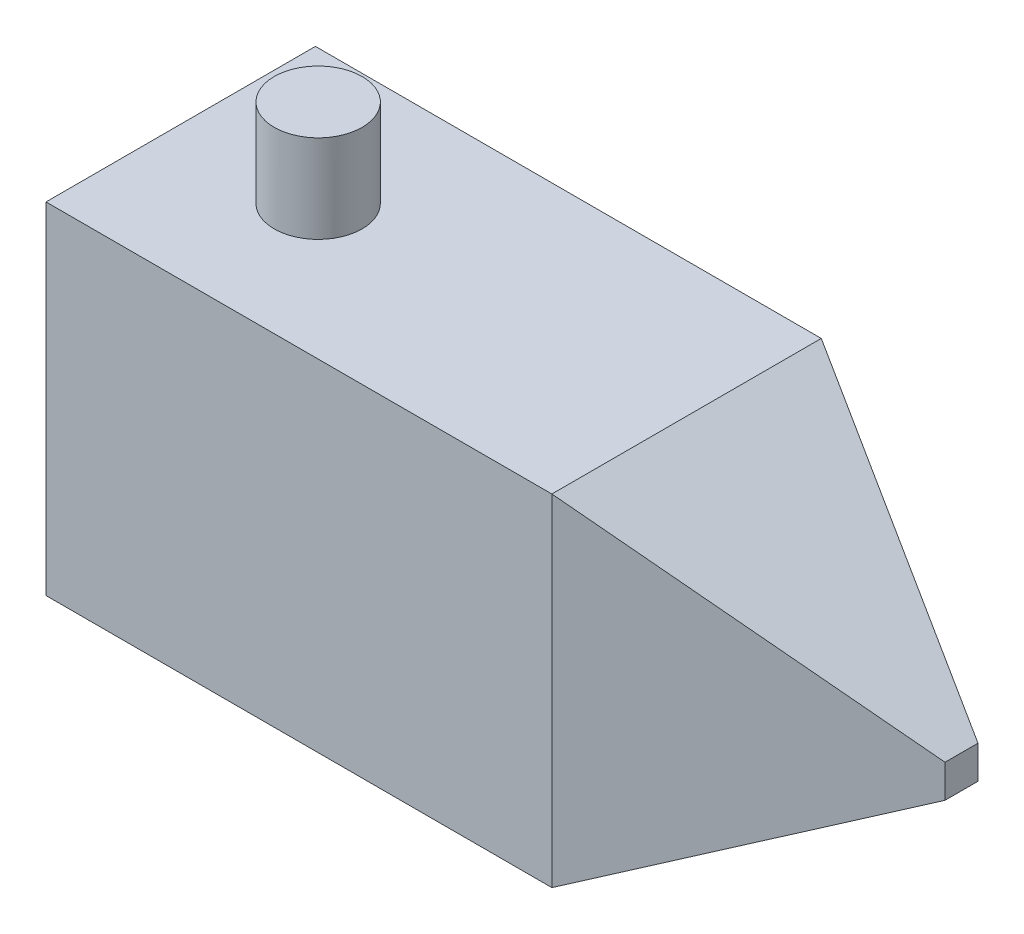
from build123d import *

# Parameters (mm, degrees)
SKETCH1_W           = 46
SKETCH1_H           = 24.5
BODY_DEPTH          = 31
SKETCH3_W           = 42
SKETCH3_H           = 20.5
SERVO_HOLE_DEPTH    = 29
CUT_EXTRUDE3_DEPTH  = 29
SKETCH6_R           = 4
BOSS_EXTRUDE3_DEPTH = 8


with BuildPart() as part:
    # Sketch1 → Body (new body)
    with BuildSketch(Plane(origin=(0, 0, 0), x_dir=(1, 0, 0), z_dir=(0, 1, 0))):
        Rectangle(SKETCH1_W, SKETCH1_H)
    extrude(amount=BODY_DEPTH)

    # Sketch3 → Servo Hole (cut)
    with BuildSketch(Plane(origin=(0, 0, 0), x_dir=(1, 0, 0), z_dir=(0, 1, 0))):
        Rectangle(SKETCH3_W, SKETCH3_H)
    extrude(amount=SERVO_HOLE_DEPTH, mode=Mode.SUBTRACT)

    # Point → section 0 of loft1
    with BuildSketch(Plane(origin=(48, 0, 0), x_dir=(0, 0, -1), z_dir=(1, 0, 0)), mode=Mode.PRIVATE) as loft1_s0:
        with BuildLine():
            Line((-1.5, 14), (1.5, 14))
            Line((1.5, 14), (1.5, 17))
            Line((1.5, 17), (-1.5, 17))
            Line((-1.5, 17), (-1.5, 14))
        make_face()
    # loft up to a face of the part (loft1)
    loft([loft1_s0.sketch, part.faces().sort_by_distance((23, 15.5, 0))[0]])

    # Sketch5 → Cut-Extrude3 (cut)
    with BuildSketch(Plane.ZY.offset(23)):
        Polygon((-6, 27), (6, 27), (6, 22), (4.5, 22), (4.5, 2), (-4.5, 2), (-4.5, 22), (-6, 22), align=None)
    extrude(amount=-CUT_EXTRUDE3_DEPTH, mode=Mode.SUBTRACT)

    # Sketch6 → Boss-Extrude3 (add)
    with BuildSketch(Plane(origin=(0, 31, 0), x_dir=(1, 0, 0), z_dir=(0, 1, 0))):
        with Locations(Location((-10.5, 0, 0), (0, 0, 90))):
            Circle(SKETCH6_R)
    extrude(amount=BOSS_EXTRUDE3_DEPTH)


solid = part.part
